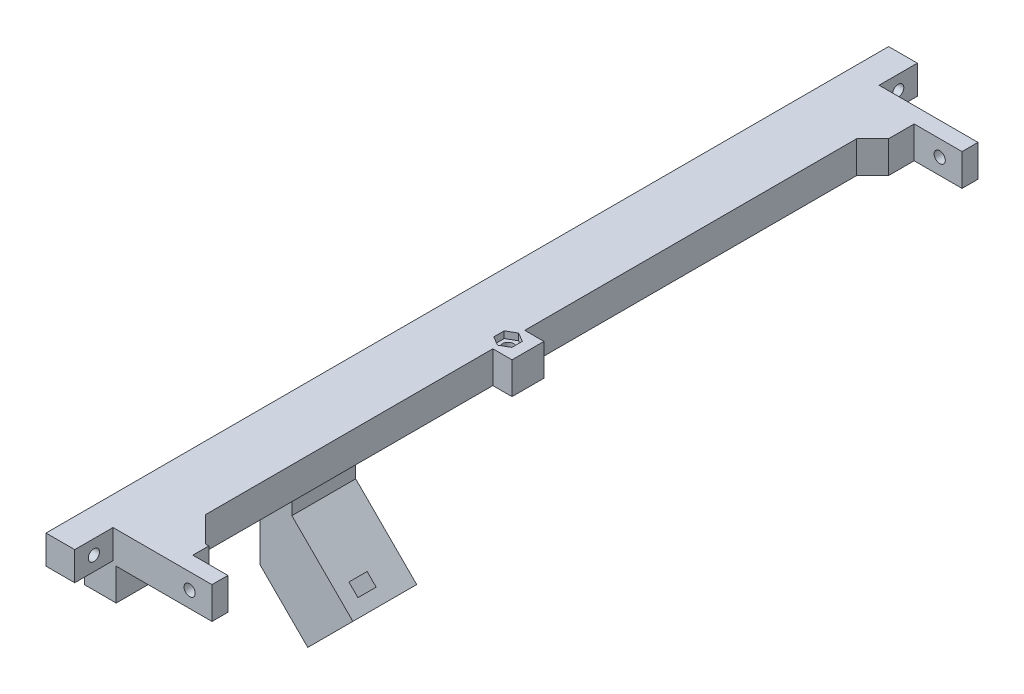
from build123d import *

# Parameters (mm, degrees)
BOSS_EXTRUDE1_DEPTH      = 240
BOSS_EXTRUDE3_DEPTH      = 10
SKETCH5_R                = 1.75
CUT_EXTRUDE1_DEPTH       = 243.69322199
SKETCH6_W                = 7
SKETCH6_H                = 12
CUT_EXTRUDE2_DEPTH       = 11
BOSS_EXTRUDE5_DEPTH      = 10
BOSS_EXTRUDE5_DEPTH_BACK = 10
SKETCH12_W               = 10
SKETCH12_H               = 10
BOSS_EXTRUDE6_DEPTH      = 6
SKETCH11_R               = 1.75
CUT_EXTRUDE6_DEPTH       = 20
SKETCH13_W               = 9
SKETCH13_H               = 9
BOSS_EXTRUDE7_DEPTH      = 12
SKETCH16_R               = 1.75
CUT_EXTRUDE10_DEPTH      = 9
CUT_EXTRUDE11_DEPTH      = 2.1
SKETCH18_R               = 3
CUT_EXTRUDE12_DEPTH      = 3.1
SKETCH19_R               = 1.75
CUT_EXTRUDE13_DEPTH      = 10
CUT_EXTRUDE14_DEPTH      = 2.1
SKETCH21_R               = 1.75
CUT_EXTRUDE15_DEPTH      = 15
SKETCH22_W               = 5.7
SKETCH22_H               = 4
CUT_EXTRUDE16_DEPTH      = 259.696024874
CUT_EXTRUDE17_DEPTH      = 10


with BuildPart() as part:
    # Sketch1 → Boss-Extrude1 (new body)
    with BuildSketch(Plane.XY):
        Polygon((-10, 0), (0, 0), (0, 10), (10, 10), (10, 20), (-10, 20), align=None)
    extrude(amount=BOSS_EXTRUDE1_DEPTH)

    # Sketch4 → Boss-Extrude3 (add)
    with BuildSketch(Plane(origin=(0, 20, 0), x_dir=(1, 0, 0), z_dir=(0, 1, 0))):
        Polygon((10, 0), (30, 0), (30, -10), (18, -10), (10, -18), align=None)
    boss_extrude3 = extrude(amount=-BOSS_EXTRUDE3_DEPTH)

    # Sketch5 → Cut-Extrude1 (cut, through all)
    with BuildSketch(Plane(origin=(0, 0, 0), x_dir=(-1, 0, 0), z_dir=(0, 0, -1))):
        with Locations((-23, 15)):
            Circle(SKETCH5_R)
    cut_extrude1 = extrude(amount=-CUT_EXTRUDE1_DEPTH, mode=Mode.SUBTRACT)

    # Sketch6 → Cut-Extrude2 (cut)
    with BuildSketch(Plane(origin=(30, 0, 0), x_dir=(0, 0, -1), z_dir=(1, 0, 0))):
        with Locations((-8.5, 15)):
            Rectangle(SKETCH6_W, SKETCH6_H)
    cut_extrude2 = extrude(amount=-CUT_EXTRUDE2_DEPTH, mode=Mode.SUBTRACT)

    # Mirror1: Boss-Extrude3, Cut-Extrude1, Cut-Extrude2 across plane
    add(boss_extrude3.mirror(Plane(origin=(0, 0, 120), x_dir=(1, 0, 0), z_dir=(0, 0, -1))))
    add(cut_extrude1.mirror(Plane(origin=(0, 0, 120), x_dir=(1, 0, 0), z_dir=(0, 0, -1))), mode=Mode.SUBTRACT)
    add(cut_extrude2.mirror(Plane(origin=(0, 0, 120), x_dir=(1, 0, 0), z_dir=(0, 0, -1))), mode=Mode.SUBTRACT)

    # Sketch7 → Boss-Extrude5 (add, two sides: drawn at the far end of the back side and taken through both)
    with BuildSketch(Plane.XY.offset(174.97).offset(-BOSS_EXTRUDE5_DEPTH_BACK)):
        Polygon((0, 0), (0, -3.808764825), (19.120167363, -22.928932188), (4.97803174, -37.071067812), (-10, -22.093036072), (-10, 0), align=None)
    extrude(amount=BOSS_EXTRUDE5_DEPTH + BOSS_EXTRUDE5_DEPTH_BACK)

    # Sketch12 → Boss-Extrude6 (add)
    with BuildSketch(Plane(origin=(10, 0, 0), x_dir=(0, 0, -1), z_dir=(1, 0, 0))):
        with Locations((-127, 15)):
            Rectangle(SKETCH12_W, SKETCH12_H)
    extrude(amount=BOSS_EXTRUDE6_DEPTH)

    # Sketch11 → Cut-Extrude6 (cut)
    with BuildSketch(Plane(origin=(0, 20, 0), x_dir=(1, 0, 0), z_dir=(0, 1, 0))):
        with Locations(Location((9.765, -127, 0), (0, 0, 180))):
            Circle(SKETCH11_R)
    extrude(amount=-CUT_EXTRUDE6_DEPTH, mode=Mode.SUBTRACT)

    # Sketch13 → Boss-Extrude7 (add)
    with BuildSketch(Plane(origin=(0, 0, 0), x_dir=(-1, 0, 0), z_dir=(0, 0, -1))):
        with Locations((5.5, 15.5)):
            Rectangle(SKETCH13_W, SKETCH13_H)
    boss_extrude7 = extrude(amount=BOSS_EXTRUDE7_DEPTH)

    # Mirror2: Boss-Extrude7 across plane
    add(boss_extrude7.mirror(Plane.XY.offset(120)))

    # Sketch16 → Cut-Extrude10 (cut)
    with BuildSketch(Plane.ZY.offset(10)):
        with Locations(Location((-6, 15.5, 0), (0, 0, 270))):
            Circle(SKETCH16_R)
        with Locations(Location((246, 15.5, 0), (0, 0, 270))):
            Circle(SKETCH16_R)
    extrude(amount=-CUT_EXTRUDE10_DEPTH, mode=Mode.SUBTRACT)

    # Sketch17 → Cut-Extrude11 (cut)
    with BuildSketch(Plane(origin=(0, 20, 0), x_dir=(1, 0, 0), z_dir=(0, 1, 0))):
        Polygon((12.615, -128.645448267), (12.615, -125.354551733), (9.765, -123.709103466), (6.915, -125.354551733), (6.915, -128.645448267), (9.765, -130.290896534), align=None)
    extrude(amount=-CUT_EXTRUDE11_DEPTH, mode=Mode.SUBTRACT)

    # Sketch18 → Cut-Extrude12 (cut)
    with BuildSketch(Plane.ZY.offset(10)):
        with Locations(Location((246, 15.5, 0), (0, 0, 270))):
            Circle(SKETCH18_R)
        with Locations(Location((-6, 15.5, 0), (0, 0, 270))):
            Circle(SKETCH18_R)
    extrude(amount=-CUT_EXTRUDE12_DEPTH, mode=Mode.SUBTRACT)

    # Sketch19 → Cut-Extrude13 (cut)
    with BuildSketch(Plane.ZY.offset(10)):
        with Locations(Location((100, 5, 0), (0, 0, 270))):
            Circle(SKETCH19_R)
    extrude(amount=-CUT_EXTRUDE13_DEPTH, mode=Mode.SUBTRACT)

    # Sketch20 → Cut-Extrude14 (cut)
    with BuildSketch(Plane.ZY.offset(10)):
        Polygon((101.645448267, 2.15), (103.290896534, 5), (101.645448267, 7.85), (98.354551733, 7.85), (96.709103466, 5), (98.354551733, 2.15), align=None)
    extrude(amount=-CUT_EXTRUDE14_DEPTH, mode=Mode.SUBTRACT)

    # Sketch21 → Cut-Extrude15 (cut)
    with BuildSketch(Plane(origin=(21.024549776, -21.024549776, 0), x_dir=(0, 0, -1), z_dir=(0.7071067811865436, -0.7071067811865515, 0))):
        with Locations(Location((-177.71, -12.053203436, 0), (0, 0, 90))):
            Circle(SKETCH21_R)
    extrude(amount=-CUT_EXTRUDE15_DEPTH, mode=Mode.SUBTRACT)

    # Sketch22 → Cut-Extrude16 (cut, through all)
    with BuildSketch(Plane(origin=(-16.046518036, -16.046518036, 0), x_dir=(0, 0, 1), z_dir=(-0.7071067811865517, -0.7071067811865435, 0))):
        with Locations((177.71, -23.733203436)):
            Rectangle(SKETCH22_W, SKETCH22_H)
    extrude(amount=-CUT_EXTRUDE16_DEPTH, mode=Mode.SUBTRACT)

    # Sketch23 → Cut-Extrude17 (cut)
    with BuildSketch(Plane(origin=(0, 20, 0), x_dir=(1, 0, 0), z_dir=(0, 1, 0))):
        Polygon((19, -10), (19, -5), (15, -5), (15, -13), (18, -10), align=None)
    extrude(amount=-CUT_EXTRUDE17_DEPTH, mode=Mode.SUBTRACT)


solid = part.part
